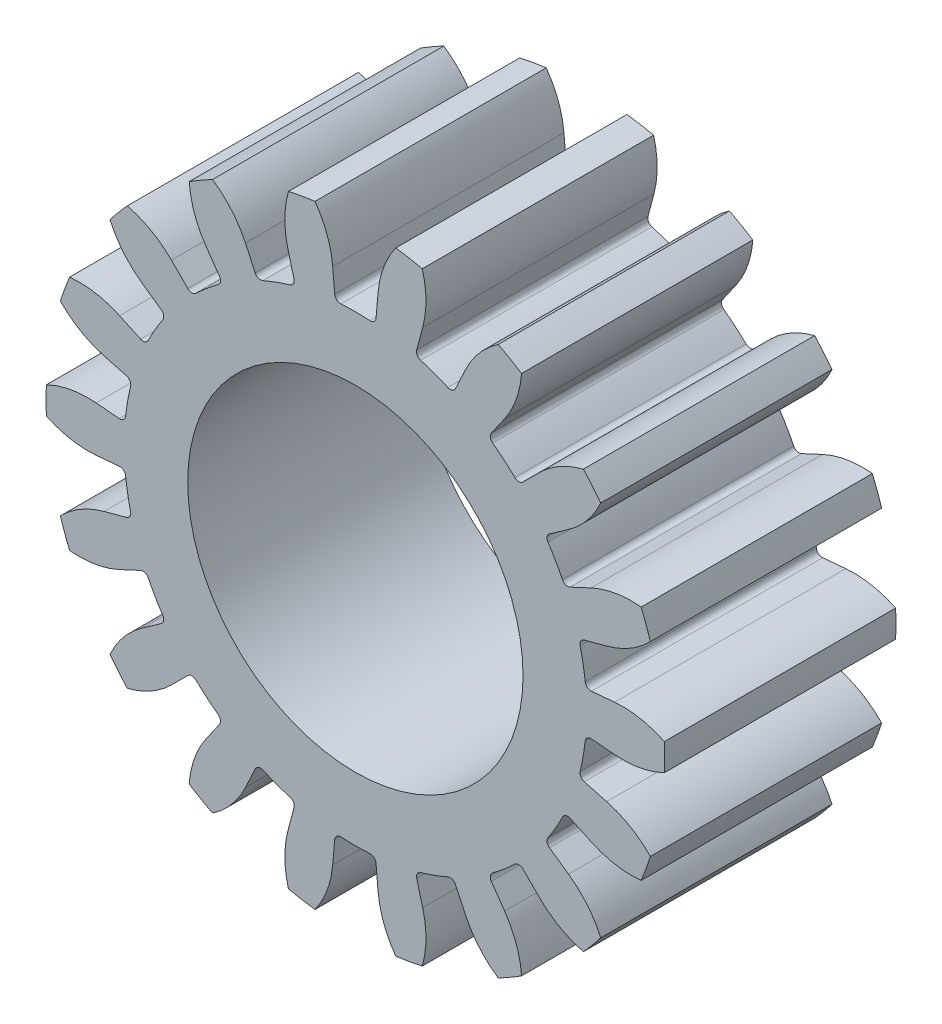
from build123d import *

# Parameters (mm, degrees)
BOSS_EXTRUDE6_DEPTH      = 4
FILLET2_R                = 0.1
CIRPATTERN5_COUNT        = 18
FILLET2_OF_CIRPATTERN5_R = 0.1
SKETCH12_R               = 2.9
CUT_EXTRUDE2_DEPTH       = 9.529792259


with BuildPart() as part:
    # Sketch9 → Boss-Extrude6 (new body)
    with BuildSketch(Plane.XY):
        with BuildLine():
            ThreePointArc((-4.482876141, -0.392200842), (-4.924658218, -0.371211749), (-5.344907985, -0.233363722))
            ThreePointArc((-5.344907985, -0.233363722), (-5.35, 0), (-5.344907985, 0.233363722))
            ThreePointArc((-5.344907985, 0.233363722), (-4.924658218, 0.371211749), (-4.482876141, 0.392200842))
            Line((-4.482876141, 0.392200842), (-3.984778792, 0.348622971))
            ThreePointArc((-3.984778792, 0.348622971), (-3.965779445, 0.522104769), (-3.939231012, 0.694592711))
            Line((-3.939231012, 0.694592711), (0, 0))
            Line((0, 0), (-3.939231012, -0.694592711))
            ThreePointArc((-3.939231012, -0.694592711), (-3.965779445, -0.522104769), (-3.984778792, -0.348622971))
            Line((-3.984778792, -0.348622971), (-4.482876141, -0.392200842))
        make_face()
    boss_extrude6 = extrude(amount=BOSS_EXTRUDE6_DEPTH)

    # Fillet2
    fillet2_edges = [part.edges().sort_by_distance(p)[0] for p in [
        (-3.984778792, 0.348622971, 2),
        (-3.984778792, -0.348622971, 2),
    ]]
    fillet(fillet2_edges, radius=FILLET2_R)

    # CirPattern5: Boss-Extrude6 ×18 about axis
    cirpattern5_axis = Axis((0, 0, 0), (0, 0, 1))
    for i in range(1, CIRPATTERN5_COUNT):
        add(boss_extrude6.rotate(cirpattern5_axis, i * 360 / CIRPATTERN5_COUNT))

    # Fillet2 of CirPattern5
    fillet2_of_cirpattern5_edges = [part.edges().sort_by_distance(p)[0] for p in [
        (-3.863703305, -1.03527618, 2),
        (-3.625231148, -1.690473047, 2),
        (-3.276608177, -2.294305745, 2),
        (-2.828427125, -2.828427125, 2),
        (-2.294305745, -3.276608177, 2),
        (-1.690473047, -3.625231148, 2),
        (-1.03527618, -3.863703305, 2),
        (-0.348622971, -3.984778792, 2),
        (0.348622971, -3.984778792, 2),
        (1.03527618, -3.863703305, 2),
        (1.690473047, -3.625231148, 2),
        (2.294305745, -3.276608177, 2),
        (2.828427125, -2.828427125, 2),
        (3.276608177, -2.294305745, 2),
        (3.625231148, -1.690473047, 2),
        (3.863703305, -1.03527618, 2),
        (3.984778792, -0.348622971, 2),
        (3.984778792, 0.348622971, 2),
        (3.863703305, 1.03527618, 2),
        (3.625231148, 1.690473047, 2),
        (3.276608177, 2.294305745, 2),
        (2.828427125, 2.828427125, 2),
        (2.294305745, 3.276608177, 2),
        (1.690473047, 3.625231148, 2),
        (1.03527618, 3.863703305, 2),
        (0.348622971, 3.984778792, 2),
        (-0.348622971, 3.984778792, 2),
        (-1.03527618, 3.863703305, 2),
        (-1.690473047, 3.625231148, 2),
        (-2.294305745, 3.276608177, 2),
        (-2.828427125, 2.828427125, 2),
        (-3.276608177, 2.294305745, 2),
        (-3.625231148, 1.690473047, 2),
        (-3.863703305, 1.03527618, 2),
    ]]
    fillet(fillet2_of_cirpattern5_edges, radius=FILLET2_OF_CIRPATTERN5_R)

    # Sketch12 → Cut-Extrude2 (cut, through all)
    with BuildSketch(Plane.XY.offset(4)):
        Circle(SKETCH12_R)
    extrude(amount=-CUT_EXTRUDE2_DEPTH, mode=Mode.SUBTRACT)


solid = part.part
